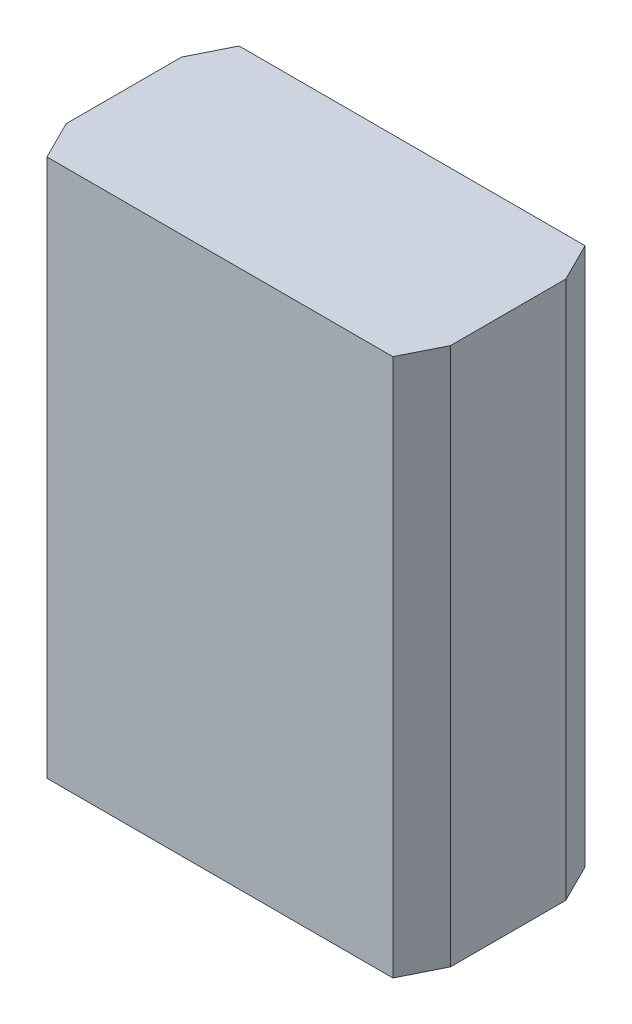
from build123d import *

# Parameters (mm, degrees)
SKETCH1_W           = 2.54
SKETCH1_H           = 2.54
MAIN_BODY_DEPTH     = 7.112
CUT_EXTRUDE_3_DEPTH = 7.112
SKETCH2_W           = 0.64
SKETCH2_H           = 0.64
CUT_EXTRUDE_4_DEPTH = 6.35


with BuildPart() as part:
    # Sketch1 → Main Body (new body)
    with BuildSketch(Plane(origin=(0, 0, 0), x_dir=(1, 0, 0), z_dir=(0, 1, 0))):
        with Locations((1.27, 1.27)):
            Rectangle(SKETCH1_W, SKETCH1_H)
    main_body = extrude(amount=MAIN_BODY_DEPTH)

    # Sketch4 → Вырез-Вытянуть3 (cut)
    with BuildSketch(Plane(origin=(0, 0, 0), x_dir=(1, 0, 0), z_dir=(0, 1, 0))):
        Polygon((2.54, 2.54), (2.286, 2.54), (2.54, 2.032), align=None)
        Polygon((2.54, 0), (2.286, 0), (2.54, 0.508), align=None)
    cut_extrude_3 = extrude(amount=CUT_EXTRUDE_3_DEPTH, mode=Mode.SUBTRACT)

    # Sketch2 → Вырез-Вытянуть4 (cut)
    with BuildSketch(Plane(origin=(0, 0, 0), x_dir=(1, 0, 0), z_dir=(0, 1, 0))):
        with Locations((1.27, 1.27)):
            Rectangle(SKETCH2_W, SKETCH2_H)
    cut_extrude_4 = extrude(amount=CUT_EXTRUDE_4_DEPTH, mode=Mode.SUBTRACT)

    # Зеркальное отражение1: Main Body, Вырез-Вытянуть3, Вырез-Вытянуть4 across Right Plane
    add(main_body.mirror(Plane(origin=(0, 0, 0), x_dir=(0, 0, -1), z_dir=(1, 0, 0))))
    add(cut_extrude_3.mirror(Plane(origin=(0, 0, 0), x_dir=(0, 0, -1), z_dir=(1, 0, 0))), mode=Mode.SUBTRACT)
    add(cut_extrude_4.mirror(Plane(origin=(0, 0, 0), x_dir=(0, 0, -1), z_dir=(1, 0, 0))), mode=Mode.SUBTRACT)


solid = part.part
